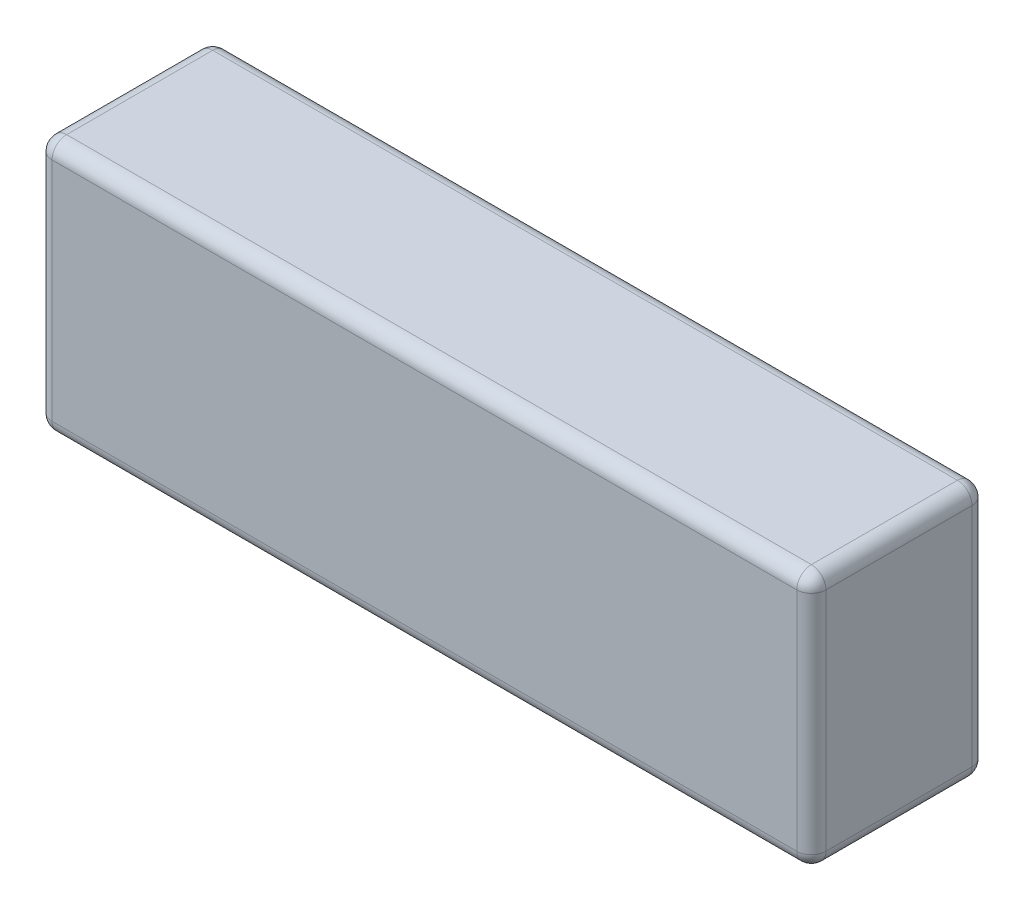
from build123d import *

# Parameters (mm, degrees)
SKETCH1_W           = 106
SKETCH1_H           = 24
BOSS_EXTRUDE1_DEPTH = 35
FILLET1_R           = 2
SKETCH2_R           = 7.98880999
BOSS_EXTRUDE2_DEPTH = 1


with BuildPart() as part:
    # Sketch1 → Boss-Extrude1 (new body)
    with BuildSketch(Plane(origin=(0, 0, 0), x_dir=(1, 0, 0), z_dir=(0, 1, 0))):
        with Locations((-9.565003902, 10.807978011)):
            Rectangle(SKETCH1_W, SKETCH1_H)
    extrude(amount=BOSS_EXTRUDE1_DEPTH)

    # Fillet1
    fillet1_edges = [part.edges().sort_by_distance(p)[0] for p in [
        (43.434996098, 35, -10.807978011),
        (-9.565003902, 35, -22.807978011),
        (-62.565003902, 35, -10.807978011),
        (-9.565003902, 0, -22.807978011),
        (43.434996098, 0, -10.807978011),
        (-9.565003902, 0, 1.192021989),
        (-62.565003902, 0, -10.807978011),
        (-62.565003902, 17.5, -22.807978011),
        (43.434996098, 17.5, -22.807978011),
        (43.434996098, 17.5, 1.192021989),
        (-62.565003902, 17.5, 1.192021989),
        (-9.565003902, 35, 1.192021989),
    ]]
    fillet(fillet1_edges, radius=FILLET1_R)

    # Sketch2 → Boss-Extrude2 (add)
    with BuildSketch(Plane.ZY.offset(62.565003902)):
        with Locations(Location((-11.446505624, 18.72084807, 0), (0, 0, 180))):
            Circle(SKETCH2_R)
    extrude(amount=BOSS_EXTRUDE2_DEPTH)


solid = part.part
